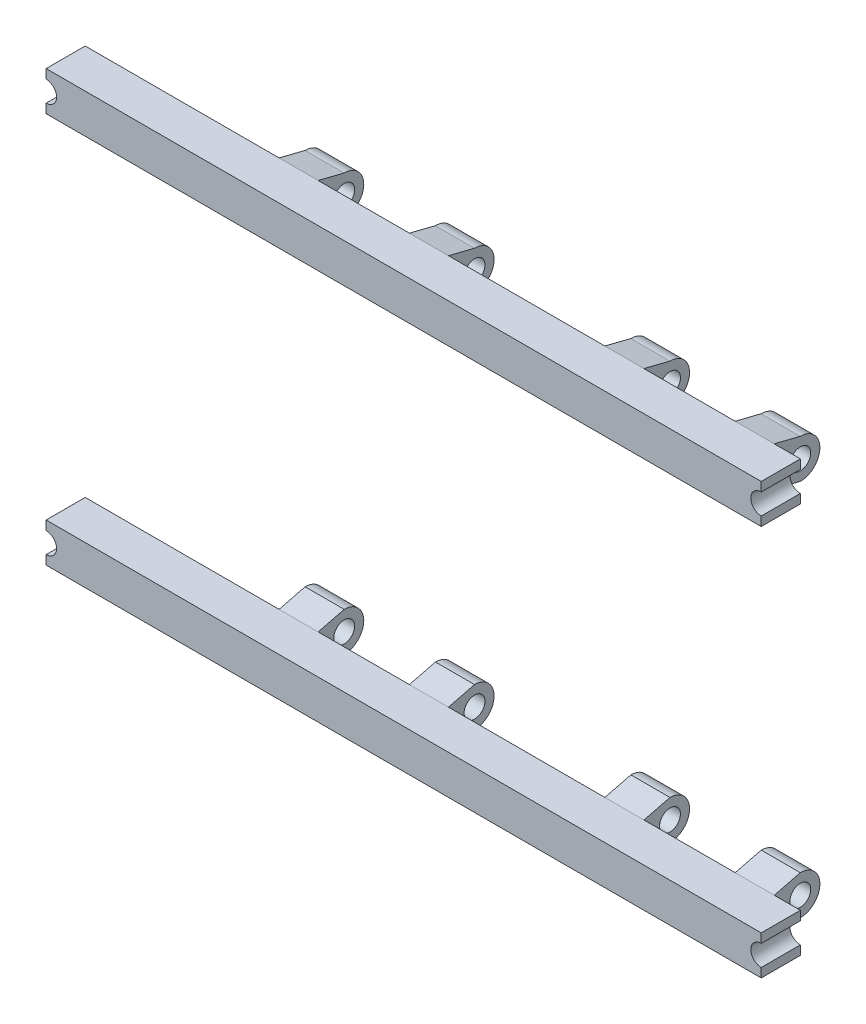
from build123d import *

# Parameters (mm, degrees)
SKETCH1_W             = 109.75
SKETCH1_H             = 6
BOSS_EXTRUDE1_DEPTH   = 6
BOSS_EXTRUDE1_2_DEPTH = 6
BOSS_EXTRUDE2_START   = -4
SKETCH2_R             = 1.6
BOSS_EXTRUDE2_DEPTH   = 6
LPATTERN1_COUNT       = 8
LPATTERN1_PITCH       = 10
CUT_EXTRUDE1_REACH    = 249.551
SKETCH3_R             = 1.6


with BuildPart() as part:
    # Sketch1 → Boss-Extrude1 (new body)
    with BuildSketch(Plane.XY):
        with Locations((57.875, -217)):
            Rectangle(SKETCH1_W, SKETCH1_H)
    extrude(amount=-BOSS_EXTRUDE1_DEPTH)



with BuildPart() as body_2:
    # Sketch1 → Boss-Extrude1 2 (new body)
    with BuildSketch(Plane.XY):
        with Locations((57.875, -157)):
            Rectangle(SKETCH1_W, SKETCH1_H)
    extrude(amount=-BOSS_EXTRUDE1_2_DEPTH)


with BuildPart() as part_1:
    add(part.part)

    add(body_2.part)  # Boss-Extrude2 merges body 2
    # Sketch2 → Boss-Extrude2 (add)
    # profile 1 of 4: a face of its own
    with BuildSketch(Plane(origin=(112.75, 0, 0), x_dir=(0, 0, -1), z_dir=(1, 0, 0)).offset(BOSS_EXTRUDE2_START)):
        with BuildLine():
            Line((10, -213), (8.588235294, -213.352941176))
            ThreePointArc((8.588235294, -213.352941176), (7.0895725, -216.727606875), (10, -219))
            ThreePointArc((10, -219), (13, -216), (10, -213))
        make_face()
        with Locations((10, -216)):
            Circle(SKETCH2_R, mode=Mode.SUBTRACT)
    # profile 2 of 4: a face of its own
    with BuildSketch(Plane(origin=(112.75, 0, 0), x_dir=(0, 0, -1), z_dir=(1, 0, 0)).offset(BOSS_EXTRUDE2_START)):
        with BuildLine():
            Line((8.588235294, -213.352941176), (6, -214))
            Line((6, -214), (6, -220))
            Line((6, -220), (10, -219))
            ThreePointArc((10, -219), (7.0895725, -216.727606875), (8.588235294, -213.352941176))
        make_face()
    # profile 3 of 4: a face of its own
    with BuildSketch(Plane(origin=(112.75, 0, 0), x_dir=(0, 0, -1), z_dir=(1, 0, 0)).offset(BOSS_EXTRUDE2_START)):
        with BuildLine():
            ThreePointArc((10, -161), (13, -158), (10, -155))
            ThreePointArc((10, -155), (7.0895725, -157.272393125), (8.588235294, -160.647058824))
            Line((8.588235294, -160.647058824), (10, -161))
        make_face()
        with Locations((10, -158)):
            Circle(SKETCH2_R, mode=Mode.SUBTRACT)
    # profile 4 of 4: a face of its own
    with BuildSketch(Plane(origin=(112.75, 0, 0), x_dir=(0, 0, -1), z_dir=(1, 0, 0)).offset(BOSS_EXTRUDE2_START)):
        with BuildLine():
            Line((10, -155), (6, -154))
            Line((6, -154), (6, -160))
            Line((6, -160), (8.588235294, -160.647058824))
            ThreePointArc((8.588235294, -160.647058824), (7.0895725, -157.272393125), (10, -155))
        make_face()
    boss_extrude2 = extrude(amount=-BOSS_EXTRUDE2_DEPTH)

    # LPattern1: Boss-Extrude2 ×8, 4 skipped
    with Locations(*[(-i * LPATTERN1_PITCH, 0, 0) for i in range(1, LPATTERN1_COUNT) if i not in (1, 3, 4, 6)]):
        add(boss_extrude2)

    # Sketch3 → Cut-Extrude1 (cut, up to next)
    with BuildSketch(Plane.XY, mode=Mode.PRIVATE) as cut_extrude1_sk1:
        with Locations((3, -217)):
            Circle(SKETCH3_R)
    cut_extrude1_tool1 = extrude(cut_extrude1_sk1.sketch, amount=-CUT_EXTRUDE1_REACH, mode=Mode.PRIVATE) & part_1.part
    # Sketch3 → Cut-Extrude1 (cut, up to next)
    with BuildSketch(Plane.XY, mode=Mode.PRIVATE) as cut_extrude1_sk2:
        with Locations((3, -157)):
            Circle(SKETCH3_R)
    cut_extrude1_tool2 = extrude(cut_extrude1_sk2.sketch, amount=-CUT_EXTRUDE1_REACH, mode=Mode.PRIVATE) & part_1.part
    # Sketch3 → Cut-Extrude1 (cut, up to next)
    with BuildSketch(Plane.XY, mode=Mode.PRIVATE) as cut_extrude1_sk3:
        with Locations((112.75, -157)):
            Circle(SKETCH3_R)
    cut_extrude1_tool3 = extrude(cut_extrude1_sk3.sketch, amount=-CUT_EXTRUDE1_REACH, mode=Mode.PRIVATE) & part_1.part
    # Sketch3 → Cut-Extrude1 (cut, up to next)
    with BuildSketch(Plane.XY, mode=Mode.PRIVATE) as cut_extrude1_sk4:
        with Locations((112.75, -217)):
            Circle(SKETCH3_R)
    cut_extrude1_tool4 = extrude(cut_extrude1_sk4.sketch, amount=-CUT_EXTRUDE1_REACH, mode=Mode.PRIVATE) & part_1.part
    add(cut_extrude1_tool1.solids().sort_by_distance((3, -217, 0))[0], mode=Mode.SUBTRACT)
    add(cut_extrude1_tool2.solids().sort_by_distance((3, -157, 0))[0], mode=Mode.SUBTRACT)
    add(cut_extrude1_tool3.solids().sort_by_distance((112.75, -157, 0))[0], mode=Mode.SUBTRACT)
    add(cut_extrude1_tool4.solids().sort_by_distance((112.75, -217, 0))[0], mode=Mode.SUBTRACT)


solid = part_1.part
